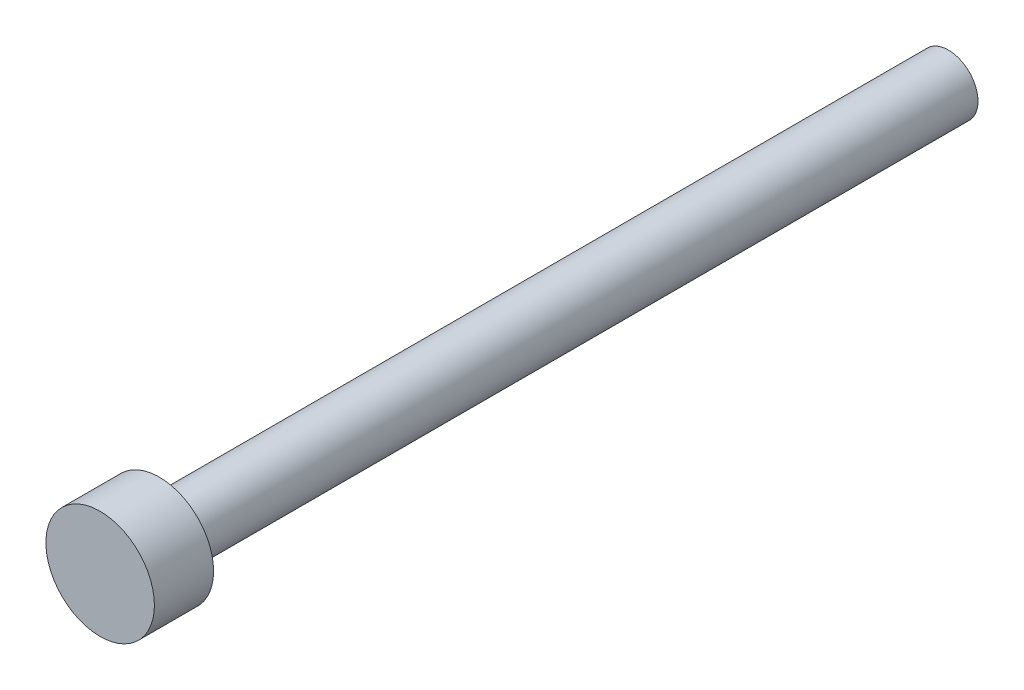
from build123d import *

# Parameters (mm, degrees)
SHANK_NOMINAL_THREAD_ENVELOPE_START     = -40
SHANK_NOMINAL_THREAD_ENVELOPE_PROFILE_R = 1.5
SHANK_NOMINAL_THREAD_ENVELOPE_DEPTH     = 40
SOCKET_HEAD_ENVELOPE_PROFILE_R          = 2.75
SOCKET_HEAD_ENVELOPE_DEPTH              = 3


with BuildPart() as part:
    # Shank_nominal_thread_envelope_profile → Shank_nominal_thread_envelope (new body)
    with BuildSketch(Plane.XY.offset(SHANK_NOMINAL_THREAD_ENVELOPE_START)):
        Circle(SHANK_NOMINAL_THREAD_ENVELOPE_PROFILE_R)
    extrude(amount=SHANK_NOMINAL_THREAD_ENVELOPE_DEPTH)

    # Socket_head_envelope_profile → Socket_head_envelope (add)
    with BuildSketch(Plane.XY):
        Circle(SOCKET_HEAD_ENVELOPE_PROFILE_R)
    extrude(amount=SOCKET_HEAD_ENVELOPE_DEPTH)


solid = part.part
